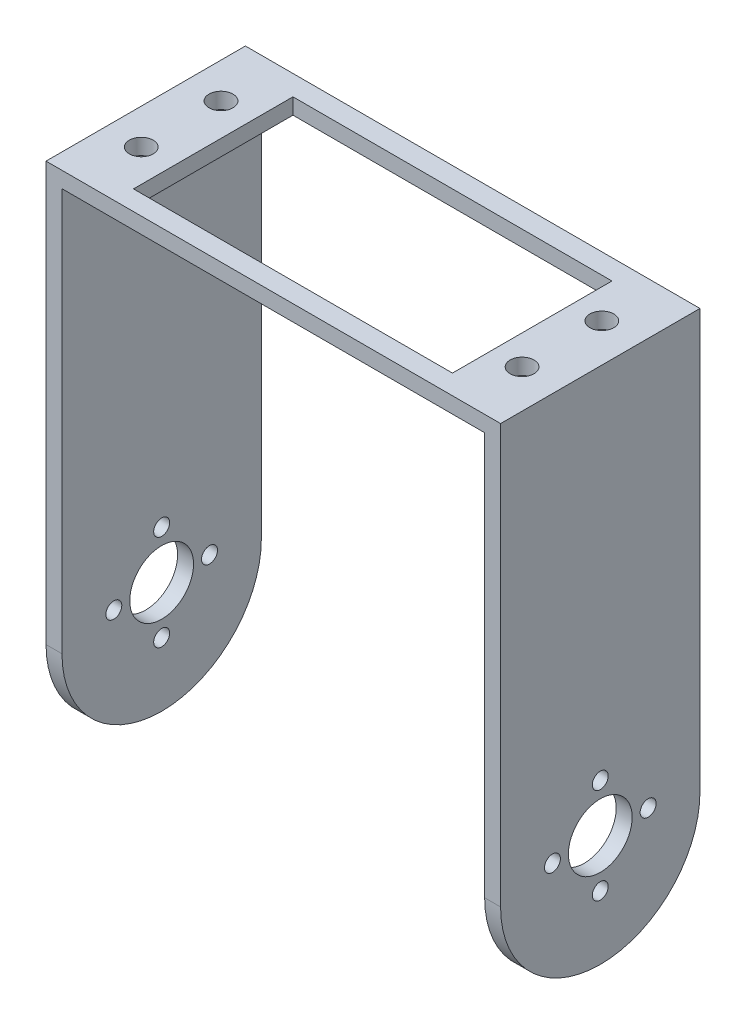
from build123d import *

# Parameters (mm, degrees)
BOSS_EXTRUDE2_DEPTH = 25
SKETCH4_R           = 4
CUT_EXTRUDE1_DEPTH  = 108.5257706
SKETCH6_R           = 4
CUT_EXTRUDE2_DEPTH  = 78.032036302
CUT_EXTRUDE3_DEPTH  = 78.032036302
SKETCH9_R           = 1
CUT_EXTRUDE4_DEPTH  = 78.032036302
SKETCH10_R          = 1
CUT_EXTRUDE5_DEPTH  = 108.5257706
SKETCH11_R          = 1.5
SKETCH11_W          = 40
SKETCH11_H          = 20
CUT_EXTRUDE6_DEPTH  = 10


with BuildPart() as part:
    # Sketch3 → Boss-Extrude2 (new body)
    with BuildSketch(Plane.XY):
        Polygon((-79.925523148, 45.386502584), (-27.042967192, 45.386502584), (-24.925523148, 45.386502584), (-24.925523148, -19.613497416), (-26.925523148, -19.613497416), (-26.925523148, 43.389953837), (-79.925523148, 43.389953837), (-79.925523148, -19.613497416), (-81.925523148, -19.613497416), (-81.925523148, 45.386502584), align=None)
    extrude(amount=BOSS_EXTRUDE2_DEPTH)

    # Sketch4 → Cut-Extrude1 (cut, through all)
    with BuildSketch(Plane(origin=(0, 45.386502584, 0), x_dir=(1, 0, 0), z_dir=(0, 1, 0))):
        with Locations(Location((-54.925523148, -12.5, 0), (0, 0, 270))):
            Circle(SKETCH4_R)
    extrude(amount=-CUT_EXTRUDE1_DEPTH, mode=Mode.SUBTRACT)

    # Sketch6 → Cut-Extrude2 (cut, through all)
    with BuildSketch(Plane.ZY.offset(81.925523148)):
        with Locations(Location((12.5, -5.613497416, 0), (0, 0, 270))):
            Circle(SKETCH6_R)
    extrude(amount=-CUT_EXTRUDE2_DEPTH, mode=Mode.SUBTRACT)

    # Sketch8 → Cut-Extrude3 (cut, through all)
    with BuildSketch(Plane.ZY.offset(81.925523148)):
        with BuildLine():
            Line((0, -19.613497416), (12.5, -19.613497416))
            ThreePointArc((12.5, -19.613497416), (3.661165213, -15.952332159), (0, -7.113497352))
            Line((0, -7.113497352), (0, -19.613497416))
        make_face()
        with BuildLine():
            Line((12.5, -19.613497416), (25, -19.613497416))
            Line((25, -19.613497416), (25, -7.113497416))
            ThreePointArc((25, -7.113497416), (21.338834765, -15.952332181), (12.5, -19.613497416))
        make_face()
    extrude(amount=-CUT_EXTRUDE3_DEPTH, mode=Mode.SUBTRACT)

    # Sketch9 → Cut-Extrude4 (cut, through all)
    with BuildSketch(Plane(origin=(-24.925523148, 0, 0), x_dir=(0, 0, -1), z_dir=(1, 0, 0))):
        with Locations(Location((-6.5, -5.613497416, 0), (0, 0, 90))):
            Circle(SKETCH9_R)
        with Locations(Location((-12.5, -11.613497416, 0), (0, 0, 90))):
            Circle(SKETCH9_R)
        with Locations(Location((-18.5, -5.613497416, 0), (0, 0, 90))):
            Circle(SKETCH9_R)
        with Locations(Location((-12.5, 0.386502584, 0), (0, 0, 90))):
            Circle(SKETCH9_R)
    extrude(amount=-CUT_EXTRUDE4_DEPTH, mode=Mode.SUBTRACT)

    # Sketch10 → Cut-Extrude5 (cut, through all)
    with BuildSketch(Plane(origin=(0, 45.386502584, 0), x_dir=(1, 0, 0), z_dir=(0, 1, 0))):
        with Locations(Location((-60.925523148, -12.154997531, 0), (0, 0, 270))):
            Circle(SKETCH10_R)
        with Locations(Location((-54.580522888, -6.49999994, 0), (0, 0, 270))):
            Circle(SKETCH10_R)
        with Locations(Location((-48.925525297, -12.845000201, 0), (0, 0, 270))):
            Circle(SKETCH10_R)
        with Locations(Location((-55.270525558, -18.499997791, 0), (0, 0, 270))):
            Circle(SKETCH10_R)
    extrude(amount=-CUT_EXTRUDE5_DEPTH, mode=Mode.SUBTRACT)

    # Sketch11 → Cut-Extrude6 (cut)
    with BuildSketch(Plane(origin=(0, 45.386502584, 0), x_dir=(1, 0, 0), z_dir=(0, 1, 0))):
        with Locations(Location((-77.486757697, -7.5, 0), (0, 0, 270))):
            Circle(SKETCH11_R)
        with Locations(Location((-77.486757697, -17.5, 0), (0, 0, 270))):
            Circle(SKETCH11_R)
        with Locations(Location((-29.732572802, -17.5, 0), (0, 0, 270))):
            Circle(SKETCH11_R)
        with Locations(Location((-29.732572802, -7.5, 0), (0, 0, 270))):
            Circle(SKETCH11_R)
        with Locations((-53.425523148, -12.535744512)):
            Rectangle(SKETCH11_W, SKETCH11_H)
    extrude(amount=-CUT_EXTRUDE6_DEPTH, mode=Mode.SUBTRACT)


solid = part.part
